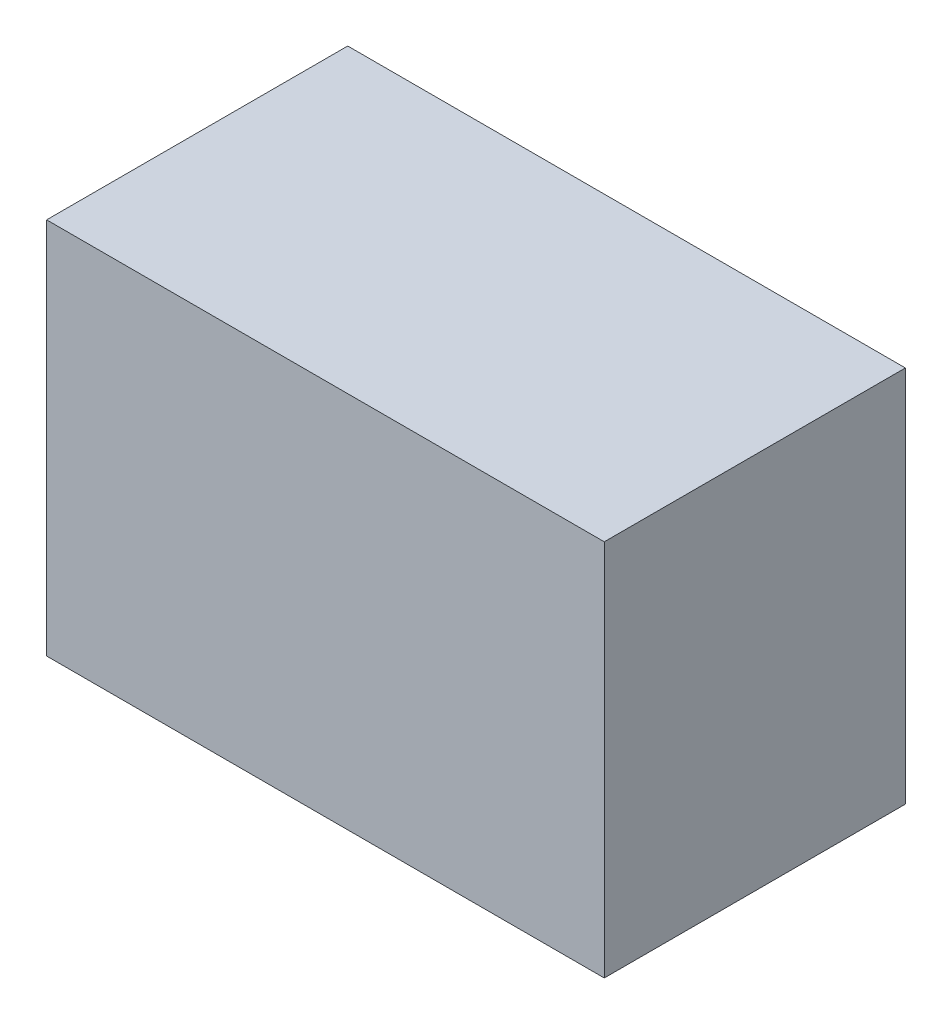
from build123d import *

# Parameters (mm, degrees)
SKETCH1_W           = 92.6
SKETCH1_H           = 62.73
BOSS_EXTRUDE1_DEPTH = 50


with BuildPart() as part:
    # Sketch1 → Boss-Extrude1 (new body)
    with BuildSketch(Plane.XY):
        Rectangle(SKETCH1_W, SKETCH1_H)
    extrude(amount=BOSS_EXTRUDE1_DEPTH)


solid = part.part
